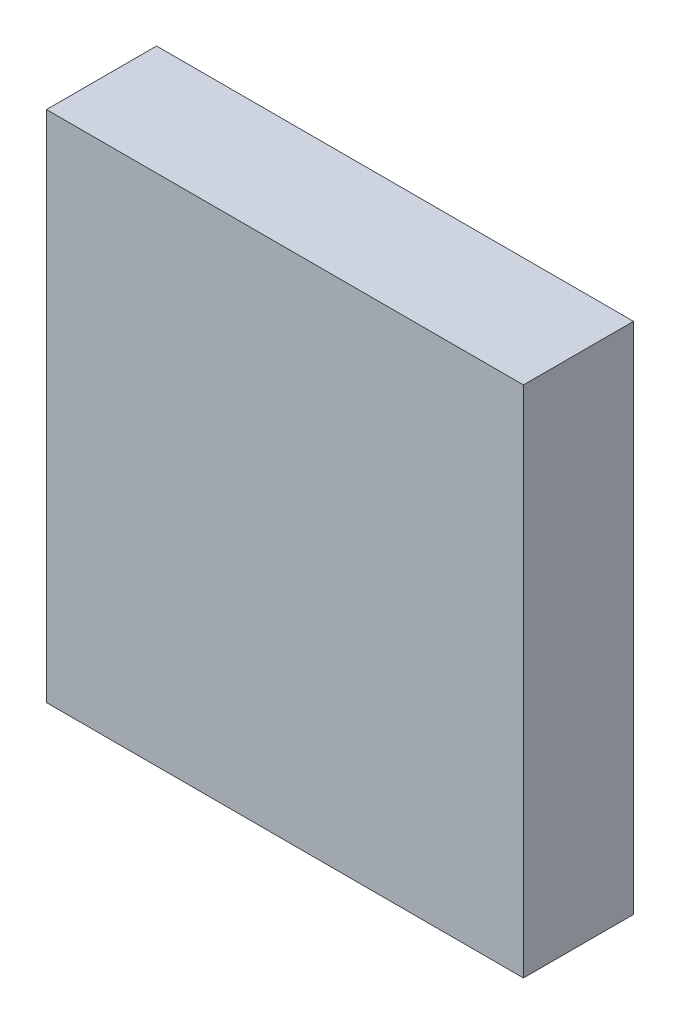
from build123d import *

# Parameters (mm, degrees)
SKETCH1_W           = 13
SKETCH1_H           = 14
BOSS_EXTRUDE1_DEPTH = 3


with BuildPart() as part:
    # Sketch1 → Boss-Extrude1 (new body)
    with BuildSketch(Plane.XY):
        with Locations((6.5, 7)):
            Rectangle(SKETCH1_W, SKETCH1_H)
    extrude(amount=BOSS_EXTRUDE1_DEPTH)


solid = part.part
